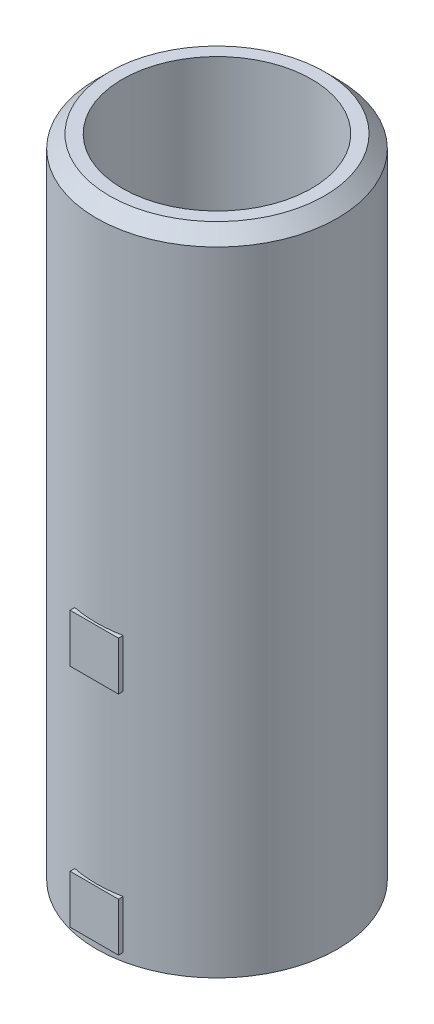
from build123d import *

# Parameters (mm, degrees)
SKETCH1_R                       = 18.65
SKETCH1_R_2                     = 14.65
BOSS_EXTRUDE1_DEPTH             = 100
BOSS_EXTRUDE2_REACH             = 110.347
BOSS_EXTRUDE2_END_RADIUS        = 18.65
SKETCH3_W                       = 7.5
SKETCH3_H                       = 7.5
BOSS_EXTRUDE2_DIRECTION_2_DEPTH = 0.35
BOSS_EXTRUDE3_REACH             = 110.468
BOSS_EXTRUDE3_END_RADIUS        = 18.65
SKETCH4_W                       = 7.5
SKETCH4_H                       = 7.5
BOSS_EXTRUDE3_DIRECTION_2_DEPTH = 0.35
CHAMFER1_SIZE                   = 2


with BuildPart() as part:
    # Sketch1 → Boss-Extrude1 (new body)
    with BuildSketch(Plane(origin=(0, 0, 0), x_dir=(1, 0, 0), z_dir=(0, 1, 0))):
        Circle(SKETCH1_R)
        Circle(SKETCH1_R_2, mode=Mode.SUBTRACT)
    extrude(amount=BOSS_EXTRUDE1_DEPTH)

    # Boss-Extrude2: up to this cylinder (the profile starts outside it)
    boss_extrude2_end = Plane(origin=(0, 22.5, 0), z_dir=(0, -1, 0)) * Cylinder(BOSS_EXTRUDE2_END_RADIUS, 293.994, mode=Mode.PRIVATE)
    # Sketch3 → Boss-Extrude2 (add, up to the surface)
    with BuildSketch(Plane.XY.offset(18.65), mode=Mode.PRIVATE) as boss_extrude2_sk1:
        with Locations((0, 5)):
            Rectangle(SKETCH3_W, SKETCH3_H)
    boss_extrude2_tool1 = extrude(boss_extrude2_sk1.sketch, amount=-BOSS_EXTRUDE2_REACH, mode=Mode.PRIVATE) - boss_extrude2_end
    add(boss_extrude2_tool1.solids().sort_by_distance((0, 5, 18.65))[0])
    add(boss_extrude2_tool1.solids().sort_by_distance((0, 5, 18.65))[1])
    # Sketch3 → Boss-Extrude2 (add, up to the surface)
    with BuildSketch(Plane.XY.offset(18.65), mode=Mode.PRIVATE) as boss_extrude2_sk2:
        with Locations((0, 40)):
            Rectangle(SKETCH3_W, SKETCH3_H)
    boss_extrude2_tool2 = extrude(boss_extrude2_sk2.sketch, amount=-BOSS_EXTRUDE2_REACH, mode=Mode.PRIVATE) - boss_extrude2_end
    add(boss_extrude2_tool2.solids().sort_by_distance((0, 40, 18.65))[0])
    add(boss_extrude2_tool2.solids().sort_by_distance((0, 40, 18.65))[1])

    # Sketch3 → Boss-Extrude2 direction 2 (add)
    with BuildSketch(Plane.XY.offset(18.65)):
        with Locations((0, 5)):
            Rectangle(SKETCH3_W, SKETCH3_H)
        with Locations((0, 40)):
            Rectangle(SKETCH3_W, SKETCH3_H)
    extrude(amount=BOSS_EXTRUDE2_DIRECTION_2_DEPTH)

    # Boss-Extrude3: up to this cylinder (the profile starts outside it)
    boss_extrude3_end = Plane(origin=(0, 40, 0), z_dir=(0, -1, 0)) * Cylinder(BOSS_EXTRUDE3_END_RADIUS, 259.236, mode=Mode.PRIVATE)
    # Sketch4 → Boss-Extrude3 (add, up to the surface)
    with BuildSketch(Plane(origin=(0, 0, -18.65), x_dir=(-1, 0, 0), z_dir=(0, 0, -1)), mode=Mode.PRIVATE) as boss_extrude3_sk1:
        with Locations((0, 40)):
            Rectangle(SKETCH4_W, SKETCH4_H)
    boss_extrude3_tool1 = extrude(boss_extrude3_sk1.sketch, amount=-BOSS_EXTRUDE3_REACH, mode=Mode.PRIVATE) - boss_extrude3_end
    add(boss_extrude3_tool1.solids().sort_by_distance((0, 40, -18.65))[0])
    add(boss_extrude3_tool1.solids().sort_by_distance((0, 40, -18.65))[1])

    # Sketch4 → Boss-Extrude3 direction 2 (add)
    with BuildSketch(Plane(origin=(0, 0, -18.65), x_dir=(-1, 0, 0), z_dir=(0, 0, -1))):
        with Locations((0, 40)):
            Rectangle(SKETCH4_W, SKETCH4_H)
    extrude(amount=BOSS_EXTRUDE3_DIRECTION_2_DEPTH)

    # Chamfer1
    chamfer1_edges = [part.edges().sort_by_distance(p)[0] for p in [
        (-18.65, 100, 0),
    ]]
    chamfer(chamfer1_edges, length=CHAMFER1_SIZE)


solid = part.part
